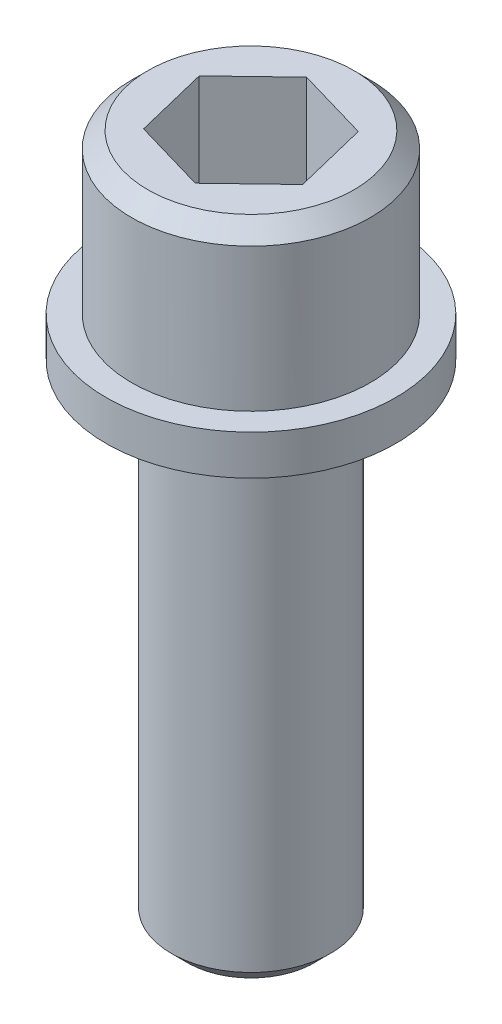
from build123d import *

# Parameters (mm, degrees)
CUT_EXTRUDE2_DEPTH = 6.35
CHAMFER1_SIZE      = 0.9652


with BuildPart() as part:
    # Sketch1 → Revolve2 (revolve)
    with BuildSketch(Plane.XY, mode=Mode.PRIVATE) as revolve2_sk:
        Polygon((0, 41.275), (7.14375, 41.275), (7.14375, 31.75), (8.6741, 31.75), (8.6741, 29.3624), (4.7625, 29.3624), (4.7625, 0), (0, 0), align=None)
    revolve(revolve2_sk.sketch.rotate(Axis((0, 41.275, 0), (0, -1, 0)), 180), axis=Axis((0, 41.275, 0), (0, -1, 0)))

    # Sketch4 → Cut-Extrude2 (cut)
    with BuildSketch(Plane(origin=(0, 41.275, 0), x_dir=(1, 0, 0), z_dir=(0, 1, 0))):
        Polygon((4.365101608, -1.269847741), (3.282271206, 3.145365012), (-1.082830402, 4.415212753), (-4.365101608, 1.269847741), (-3.282271206, -3.145365012), (1.082830402, -4.415212753), align=None)
    extrude(amount=-CUT_EXTRUDE2_DEPTH, mode=Mode.SUBTRACT)

    # Chamfer1
    chamfer1_edges = [part.edges().sort_by_distance(p)[0] for p in [
        (4.7625, 0, 0),
        (7.14375, 41.275, 0),
    ]]
    chamfer(chamfer1_edges, length=CHAMFER1_SIZE)


solid = part.part
